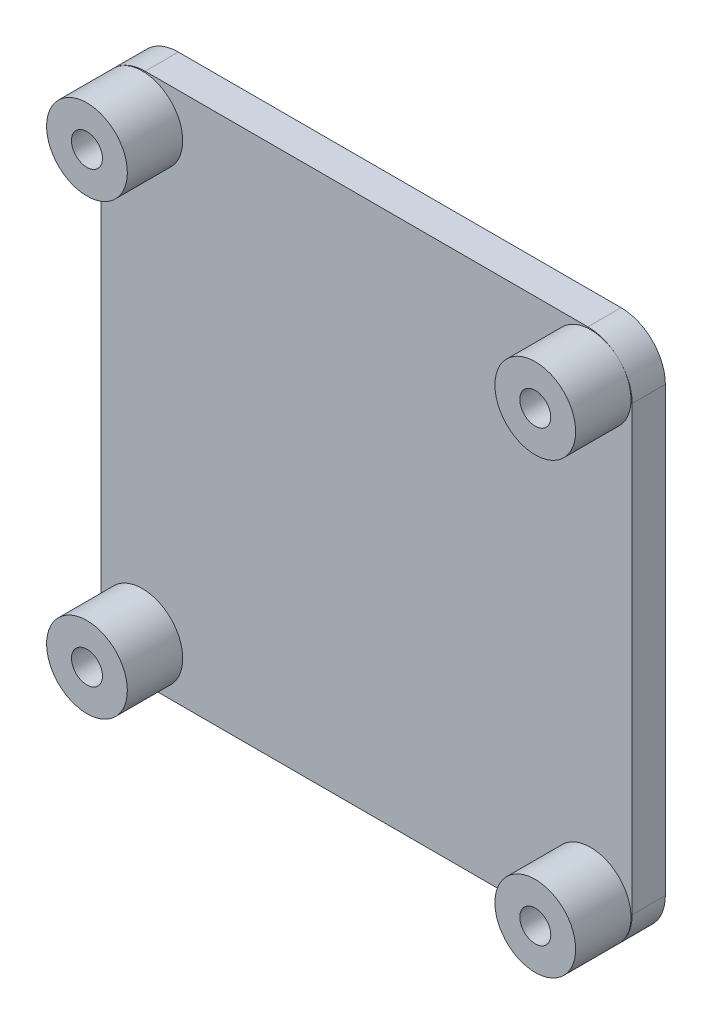
from build123d import *

# Parameters (mm, degrees)
SKETCH_1_W          = 48
SKETCH_1_H          = 48
SKETCH_1_R          = 1.4
EXTRUDE_1_DEPTH     = 3
FILLET_1_R          = 4
SKETCH_2_R          = 3.646446609
EXTRUDE_2_DEPTH     = 5
SKETCH_3_R          = 1.4
CUT_EXTRUDE_1_DEPTH = 99


with BuildPart() as part:
    # 草图1 → 凸台-拉伸1 (new body)
    with BuildSketch(Plane.XY):
        Rectangle(SKETCH_1_W, SKETCH_1_H)
        with Locations((-20.25, 20.25)):
            Circle(SKETCH_1_R, mode=Mode.SUBTRACT)
        with Locations((20.25, 20.25)):
            Circle(SKETCH_1_R, mode=Mode.SUBTRACT)
        with Locations((20.25, -20.25)):
            Circle(SKETCH_1_R, mode=Mode.SUBTRACT)
        with Locations((-20.25, -20.25)):
            Circle(SKETCH_1_R, mode=Mode.SUBTRACT)
    extrude(amount=EXTRUDE_1_DEPTH)

    # 圆角1
    fillet_1_edges = [part.edges().sort_by_distance(p)[0] for p in [
        (24, -24, 1.5),
        (-24, -24, 1.5),
        (-24, 24, 1.5),
        (24, 24, 1.5),
    ]]
    fillet(fillet_1_edges, radius=FILLET_1_R)

    # 草图2 → 凸台-拉伸2 (add)
    with BuildSketch(Plane.XY.offset(3)):
        with Locations(Location((-20.25, 20.25, 0), (0, 0, 134.998572702))):
            Circle(SKETCH_2_R)
        with Locations(Location((20.25, 20.25, 0), (0, 0, 44.998572702))):
            Circle(SKETCH_2_R)
        with Locations(Location((20.25, -20.25, 0), (0, 0, 314.998572702))):
            Circle(SKETCH_2_R)
        with Locations(Location((-20.25, -20.25, 0), (0, 0, 224.998572702))):
            Circle(SKETCH_2_R)
    extrude(amount=EXTRUDE_2_DEPTH)

    # 草图3 → 切除-拉伸1 (cut)
    with BuildSketch(Plane(origin=(0, 0, 0), x_dir=(-1, 0, 0), z_dir=(0, 0, -1))):
        with Locations(Location((-20.25, 20.25, 0), (0, 0, 180))):
            Circle(SKETCH_3_R)
        with Locations(Location((20.25, 20.25, 0), (0, 0, 180))):
            Circle(SKETCH_3_R)
        with Locations(Location((20.25, -20.25, 0), (0, 0, 180))):
            Circle(SKETCH_3_R)
        with Locations(Location((-20.25, -20.25, 0), (0, 0, 180))):
            Circle(SKETCH_3_R)
    extrude(amount=-CUT_EXTRUDE_1_DEPTH, mode=Mode.SUBTRACT)


solid = part.part
